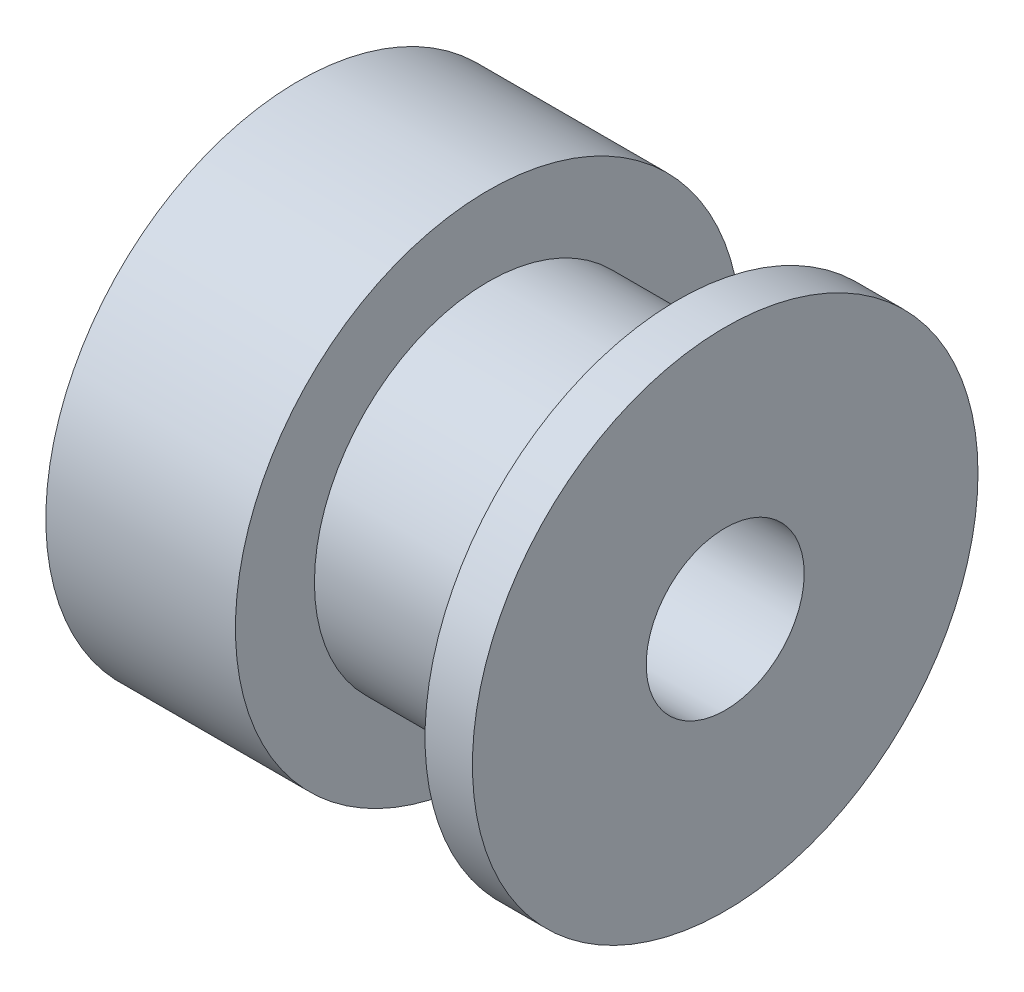
from build123d import *

# Parameters (mm, degrees)
SKETCH1_R           = 8
SKETCH1_R_2         = 2.5
BOSS_EXTRUDE1_DEPTH = 6
SKETCH2_R           = 5.5
SKETCH2_R_2         = 2.5
BOSS_EXTRUDE2_DEPTH = 6
SKETCH3_R           = 8
SKETCH3_R_2         = 2.5
BOSS_EXTRUDE3_DEPTH = 1.5


with BuildPart() as part:
    # Sketch1 → Boss-Extrude1 (new body)
    with BuildSketch(Plane(origin=(0, 0, 0), x_dir=(0, 0, -1), z_dir=(1, 0, 0))):
        Circle(SKETCH1_R)
        Circle(SKETCH1_R_2, mode=Mode.SUBTRACT)
    extrude(amount=BOSS_EXTRUDE1_DEPTH)

    # Sketch2 → Boss-Extrude2 (add)
    with BuildSketch(Plane(origin=(6, 0, 0), x_dir=(0, 0, -1), z_dir=(1, 0, 0))):
        Circle(SKETCH2_R)
        Circle(SKETCH2_R_2, mode=Mode.SUBTRACT)
    extrude(amount=BOSS_EXTRUDE2_DEPTH)

    # Sketch3 → Boss-Extrude3 (add)
    with BuildSketch(Plane(origin=(12, 0, 0), x_dir=(0, 0, -1), z_dir=(1, 0, 0))):
        Circle(SKETCH3_R)
        Circle(SKETCH3_R_2, mode=Mode.SUBTRACT)
    extrude(amount=BOSS_EXTRUDE3_DEPTH)


solid = part.part
